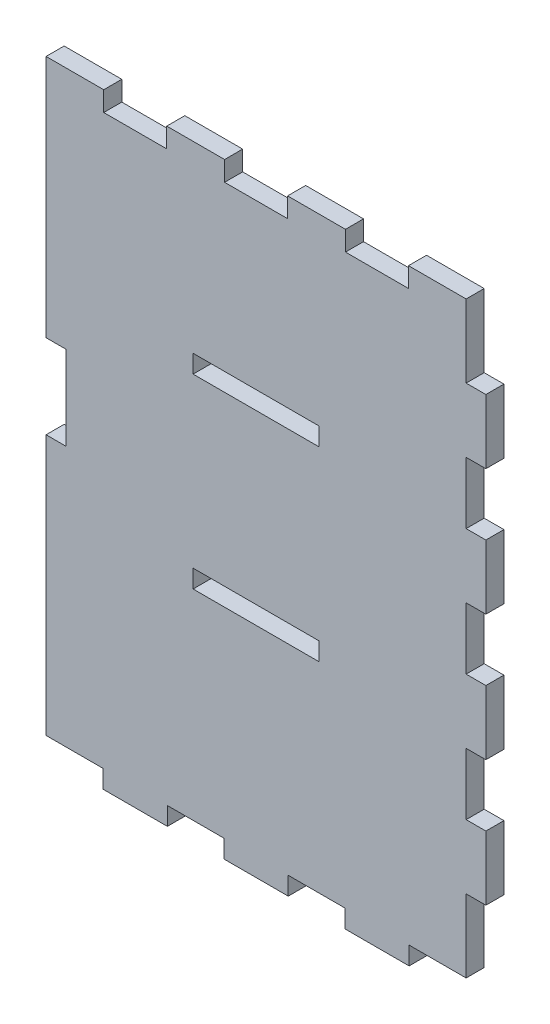
from build123d import *

# Parameters (mm, degrees)
SKETCH2_W           = 30
SKETCH2_H           = 4.3
BOSS_EXTRUDE1_DEPTH = 4.3


with BuildPart() as part:
    # Sketch2 → Boss-Extrude1 (new body)
    with BuildSketch(Plane.XY):
        Polygon((100, 0), (100, 17.35), (104.7, 17.35), (104.7, 32.65), (100, 32.65), (100, 47.35), (104.7, 47.35), (104.7, 62.65), (100, 62.65), (100, 77.35), (104.7, 77.35), (104.7, 92.65), (100, 92.65), (100, 107.35), (104.7, 107.35), (104.7, 122.65), (100, 122.65), (100, 140), (86.275, 140), (86.275, 135.3), (71.275, 135.3), (71.275, 140), (57.5, 140), (57.5, 135.3), (42.5, 135.3), (42.5, 140), (28.725, 140), (28.725, 135.3), (13.725, 135.3), (13.725, 140), (0, 140), (0, 82), (4.7, 82), (4.7, 62), (0, 62), (0, 0), (13.575, 0), (13.575, -4.3), (28.875, -4.3), (28.875, 0), (42.35, 0), (42.35, -4.3), (57.65, -4.3), (57.65, 0), (71.125, 0), (71.125, -4.3), (86.425, -4.3), (86.425, 0), align=None)
        with Locations((50, 49.85)):
            Rectangle(SKETCH2_W, SKETCH2_H, mode=Mode.SUBTRACT)
        with Locations((50, 94.15)):
            Rectangle(SKETCH2_W, SKETCH2_H, mode=Mode.SUBTRACT)
    extrude(amount=BOSS_EXTRUDE1_DEPTH)


solid = part.part
